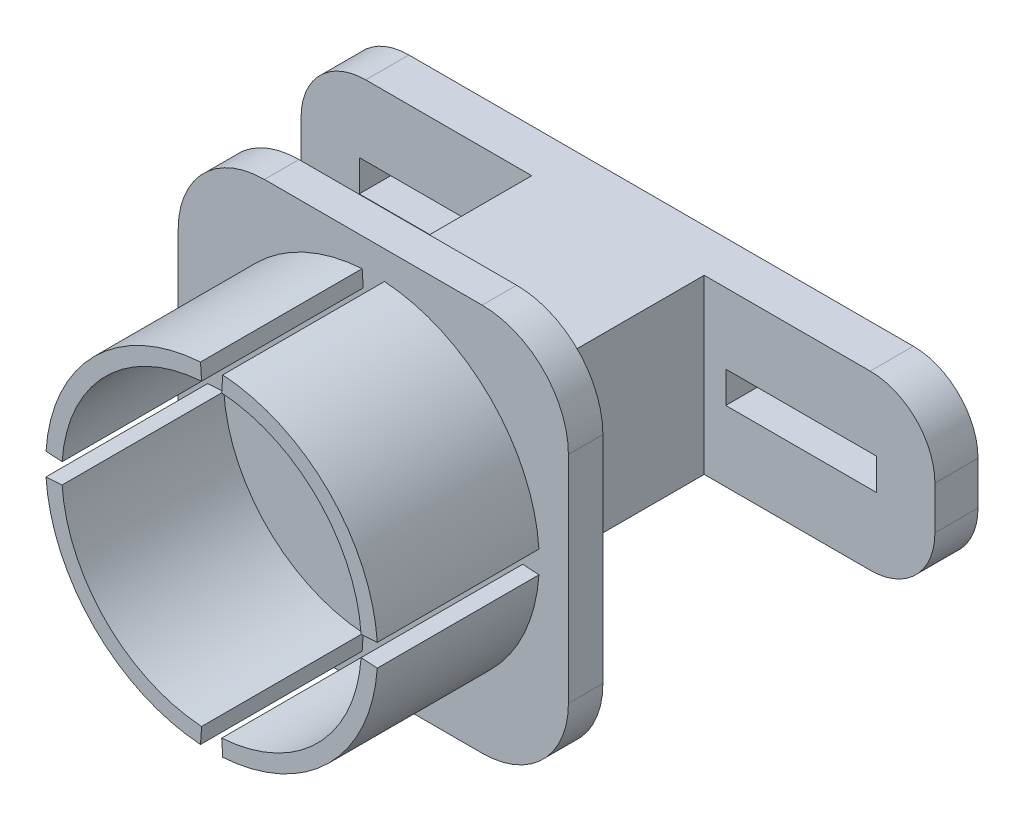
from build123d import *

# Parameters (mm, degrees)
SKETCH1_W           = 7
SKETCH1_H           = 1.46
BOSS_EXTRUDE1_DEPTH = 2
SKETCH2_W           = 8
SKETCH2_H           = 8
BOSS_EXTRUDE2_DEPTH = 11.74993
BOSS_EXTRUDE3_DEPTH = 1.6
SKETCH4_R           = 7.7
BOSS_EXTRUDE4_DEPTH = 7.5
SKETCH5_R           = 6.95
CUT_EXTRUDE1_DEPTH  = 7.5
CUT_EXTRUDE2_DEPTH  = 7.5
CIRPATTERN1_COUNT   = 4


with BuildPart() as part:
    # Sketch1 → Boss-Extrude1 (new body)
    with BuildSketch(Plane.XY):
        with BuildLine():
            Line((-11.7, 4), (11.7, 4))
            ThreePointArc((11.7, 4), (13.821320344, 3.121320344), (14.7, 1))
            Line((14.7, 1), (14.7, -1))
            ThreePointArc((14.7, -1), (13.821320344, -3.121320344), (11.7, -4))
            Line((11.7, -4), (-11.7, -4))
            ThreePointArc((-11.7, -4), (-13.821320344, -3.121320344), (-14.7, -1))
            Line((-14.7, -1), (-14.7, 1))
            ThreePointArc((-14.7, 1), (-13.821320344, 3.121320344), (-11.7, 4))
        make_face()
        with Locations((-8.5, 0)):
            Rectangle(SKETCH1_W, SKETCH1_H, mode=Mode.SUBTRACT)
        with Locations((8.5, 0)):
            Rectangle(SKETCH1_W, SKETCH1_H, mode=Mode.SUBTRACT)
    extrude(amount=BOSS_EXTRUDE1_DEPTH)

    # Sketch2 → Boss-Extrude2 (add)
    with BuildSketch(Plane.XY):
        Rectangle(SKETCH2_W, SKETCH2_H)
    extrude(amount=BOSS_EXTRUDE2_DEPTH)

    # Sketch3 → Boss-Extrude3 (add)
    with BuildSketch(Plane.XY.offset(11.74993)):
        with BuildLine():
            Line((-5.05, 9.000108401), (5.05, 9.000108401))
            ThreePointArc((5.05, 9.000108401), (7.878427125, 7.828535526), (9.05, 5.000108401))
            Line((9.05, 5.000108401), (9.05, -5.000108401))
            ThreePointArc((9.05, -5.000108401), (7.878427125, -7.828535526), (5.05, -9.000108401))
            Line((5.05, -9.000108401), (-5.05, -9.000108401))
            ThreePointArc((-5.05, -9.000108401), (-7.878427125, -7.828535526), (-9.05, -5.000108401))
            Line((-9.05, -5.000108401), (-9.05, 5.000108401))
            ThreePointArc((-9.05, 5.000108401), (-7.878427125, 7.828535526), (-5.05, 9.000108401))
        make_face()
    extrude(amount=BOSS_EXTRUDE3_DEPTH)

    # Sketch4 → Boss-Extrude4 (add)
    with BuildSketch(Plane.XY.offset(13.34993)):
        Circle(SKETCH4_R)
    extrude(amount=BOSS_EXTRUDE4_DEPTH)

    # Sketch5 → Cut-Extrude1 (cut)
    with BuildSketch(Plane.XY.offset(13.34993)):
        Circle(SKETCH5_R)
    extrude(amount=CUT_EXTRUDE1_DEPTH, mode=Mode.SUBTRACT)

    # Sketch11 → Cut-Extrude2 (cut)
    with BuildSketch(Plane.XY.offset(13.34993)):
        Polygon((0, 8.183776361), (-0.55, 8.183776361), (0, 0), (0.55, 8.183776361), align=None)
    cut_extrude2 = extrude(amount=CUT_EXTRUDE2_DEPTH, mode=Mode.SUBTRACT)

    # CirPattern1: Cut-Extrude2 ×4 about axis
    cirpattern1_axis = Axis((0, 0, 20.84993), (0, 0, -1))
    for i in range(1, CIRPATTERN1_COUNT):
        add(cut_extrude2.rotate(cirpattern1_axis, i * 360 / CIRPATTERN1_COUNT), mode=Mode.SUBTRACT)


solid = part.part
